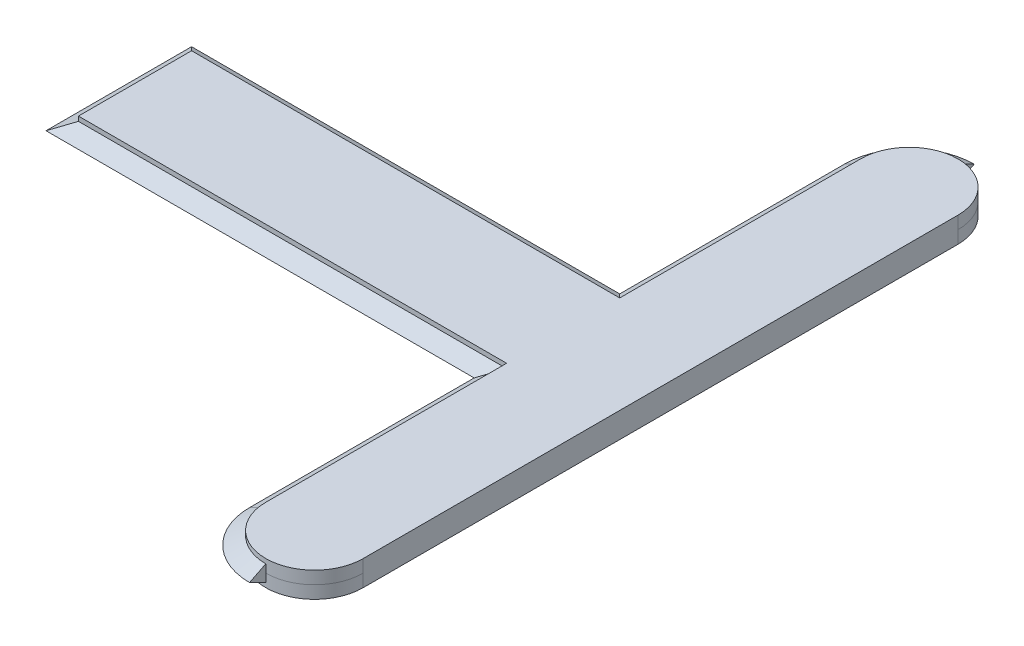
from build123d import *

# Parameters (mm, degrees)
BOSS_EXTRUDE1_DEPTH = 6


with BuildPart() as part:
    # Sketch1 → Boss-Extrude1 (new body)
    with BuildSketch(Plane(origin=(0, 0, 0), x_dir=(1, 0, 0), z_dir=(0, 1, 0))):
        with BuildLine():
            Line((0, -13.421553628), (101.6, -13.421553628))
            Line((101.6, -13.421553628), (101.6, -70.571553628))
            ThreePointArc((101.6, -70.571553628), (113.157, -82.128553628), (124.714, -70.571553628))
            Line((124.714, -70.571553628), (124.714, 70.571553628))
            ThreePointArc((124.714, 70.571553628), (113.157, 82.128553628), (101.6, 70.571553628))
            Line((101.6, 70.571553628), (101.6, 13.421553628))
            Line((101.6, 13.421553628), (0, 13.421553628))
            Line((0, 13.421553628), (0, -13.421553628))
        make_face()
    extrude(amount=BOSS_EXTRUDE1_DEPTH)

    # Sweep1: sweep along a curve in space
    with BuildLine() as sweep1_path:
        ThreePointArc((113.157, 3, 82.128553628), (104.98496693, 3, 78.743586698), (101.6, 3, 70.571553628))
        Line((101.6, 3, 70.571553628), (101.6, 3, 13.421553628))
        Line((101.6, 3, 13.421553628), (0, 3, 13.421553628))
        Line((0, 3, 13.421553628), (0, 3, -13.421553628))
        Line((0, 3, -13.421553628), (101.6, 3, -13.421553628))
        Line((101.6, 3, -13.421553628), (101.6, 3, -70.571553628))
        ThreePointArc((101.6, 3, -70.571553628), (104.98496693, 3, -78.743586698), (113.157, 3, -82.128553628))
    # Sketch4 → Sweep1 (sweep)
    with BuildSketch(Plane(origin=(113.157, 0, 0), x_dir=(0, 0, -1), z_dir=(1, 0, 0))):
        Polygon((82.128553628, 4.910343042), (82.128553628, 1.060343042), (85.978553628, 2.985343042), align=None)
    sweep(path=sweep1_path.line, transition=Transition.RIGHT)


solid = part.part
